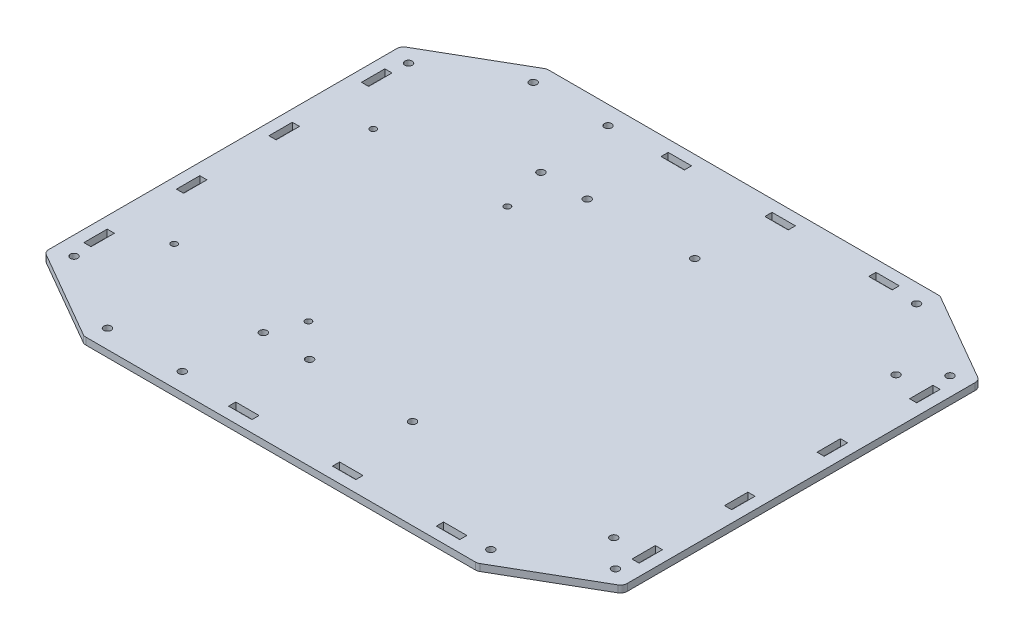
from build123d import *

# Parameters (mm, degrees)
SKETCH1_R           = 1.6
SKETCH1_W           = 10.1
SKETCH1_H           = 3.1
SKETCH1_W_2         = 3.1
SKETCH1_H_2         = 10.1
BOSS_EXTRUDE1_DEPTH = 3
CUT_EXTRUDE1_REACH  = 162.106
SKETCH3_R           = 1.35
SKETCH3_R_2         = 1.6
FILLET1_R           = 3


with BuildPart() as part:
    # Sketch1 → Boss-Extrude1 (new body)
    with BuildSketch(Plane(origin=(0, 0, 0), x_dir=(1, 0, 0), z_dir=(0, 1, 0))):
        Polygon((-85, 100), (85, 100), (125, 76.905989232), (125, -76.905989232), (85, -100), (-85, -100), (-125, -76.905989232), (-125, 76.905989232), align=None)
        with Locations(Location((-47.5, -60, 0), (0, 0, 270))):
            Circle(SKETCH1_R, mode=Mode.SUBTRACT)
        with Locations(Location((82.856406461, 92, 0), (0, 0, 270))):
            Circle(SKETCH1_R, mode=Mode.SUBTRACT)
        with Locations(Location((117, 72.287187079, 0), (0, 0, 270))):
            Circle(SKETCH1_R, mode=Mode.SUBTRACT)
        with Locations(Location((117, -72.287187079, 0), (0, 0, 270))):
            Circle(SKETCH1_R, mode=Mode.SUBTRACT)
        with Locations(Location((82.856406461, -92, 0), (0, 0, 270))):
            Circle(SKETCH1_R, mode=Mode.SUBTRACT)
        with Locations(Location((-27.5, -60, 0), (0, 0, 270))):
            Circle(SKETCH1_R, mode=Mode.SUBTRACT)
        with Locations(Location((-27.5, 60, 0), (0, 0, 270))):
            Circle(SKETCH1_R, mode=Mode.SUBTRACT)
        with Locations(Location((-117, -72.287187079, 0), (0, 0, 270))):
            Circle(SKETCH1_R, mode=Mode.SUBTRACT)
        with Locations(Location((-50.5, -92, 0), (0, 0, 270))):
            Circle(SKETCH1_R, mode=Mode.SUBTRACT)
        with Locations(Location((-47.5, 60, 0), (0, 0, 270))):
            Circle(SKETCH1_R, mode=Mode.SUBTRACT)
        with Locations(Location((-117, 72.287187079, 0), (0, 0, 270))):
            Circle(SKETCH1_R, mode=Mode.SUBTRACT)
        with Locations(Location((-50.5, 92, 0), (0, 0, 270))):
            Circle(SKETCH1_R, mode=Mode.SUBTRACT)
        with Locations(Location((-82.856406461, -92, 0), (0, 0, 270))):
            Circle(SKETCH1_R, mode=Mode.SUBTRACT)
        with Locations(Location((-82.856406461, 92, 0), (0, 0, 270))):
            Circle(SKETCH1_R, mode=Mode.SUBTRACT)
        with Locations((-22.45, -93.45)):
            Rectangle(SKETCH1_W, SKETCH1_H, mode=Mode.SUBTRACT)
        with Locations((-118.45, 60)):
            Rectangle(SKETCH1_W_2, SKETCH1_H_2, mode=Mode.SUBTRACT)
        with Locations((-118.45, 20)):
            Rectangle(SKETCH1_W_2, SKETCH1_H_2, mode=Mode.SUBTRACT)
        with Locations((-118.45, -20)):
            Rectangle(SKETCH1_W_2, SKETCH1_H_2, mode=Mode.SUBTRACT)
        with Locations((-118.45, -60)):
            Rectangle(SKETCH1_W_2, SKETCH1_H_2, mode=Mode.SUBTRACT)
        with Locations((118.45, -60)):
            Rectangle(SKETCH1_W_2, SKETCH1_H_2, mode=Mode.SUBTRACT)
        with Locations((118.45, -20)):
            Rectangle(SKETCH1_W_2, SKETCH1_H_2, mode=Mode.SUBTRACT)
        with Locations((118.45, 20)):
            Rectangle(SKETCH1_W_2, SKETCH1_H_2, mode=Mode.SUBTRACT)
        with Locations((118.45, 60)):
            Rectangle(SKETCH1_W_2, SKETCH1_H_2, mode=Mode.SUBTRACT)
        with Locations((22.45, -93.45)):
            Rectangle(SKETCH1_W, SKETCH1_H, mode=Mode.SUBTRACT)
        with Locations((67.35, -93.45)):
            Rectangle(SKETCH1_W, SKETCH1_H, mode=Mode.SUBTRACT)
        with Locations((67.35, 93.45)):
            Rectangle(SKETCH1_W, SKETCH1_H, mode=Mode.SUBTRACT)
        with Locations((22.45, 93.45)):
            Rectangle(SKETCH1_W, SKETCH1_H, mode=Mode.SUBTRACT)
        with Locations((-22.45, 93.45)):
            Rectangle(SKETCH1_W, SKETCH1_H, mode=Mode.SUBTRACT)
    extrude(amount=BOSS_EXTRUDE1_DEPTH)

    # Sketch3 → Cut-Extrude1 (cut, up to next)
    with BuildSketch(Plane(origin=(0, 3, 0), x_dir=(1, 0, 0), z_dir=(0, 1, 0)), mode=Mode.PRIVATE) as cut_extrude1_sk1:
        with Locations(Location((-100, -46, 0), (0, 0, 270))):
            Circle(SKETCH3_R)
    cut_extrude1_tool1 = extrude(cut_extrude1_sk1.sketch, amount=-CUT_EXTRUDE1_REACH, mode=Mode.PRIVATE) & part.part
    # Sketch3 → Cut-Extrude1 (cut, up to next)
    with BuildSketch(Plane(origin=(0, 3, 0), x_dir=(1, 0, 0), z_dir=(0, 1, 0)), mode=Mode.PRIVATE) as cut_extrude1_sk2:
        with Locations(Location((-42, -46, 0), (0, 0, 270))):
            Circle(SKETCH3_R)
    cut_extrude1_tool2 = extrude(cut_extrude1_sk2.sketch, amount=-CUT_EXTRUDE1_REACH, mode=Mode.PRIVATE) & part.part
    # Sketch3 → Cut-Extrude1 (cut, up to next)
    with BuildSketch(Plane(origin=(0, 3, 0), x_dir=(1, 0, 0), z_dir=(0, 1, 0)), mode=Mode.PRIVATE) as cut_extrude1_sk3:
        with Locations(Location((-42, 40, 0), (0, 0, 270))):
            Circle(SKETCH3_R)
    cut_extrude1_tool3 = extrude(cut_extrude1_sk3.sketch, amount=-CUT_EXTRUDE1_REACH, mode=Mode.PRIVATE) & part.part
    # Sketch3 → Cut-Extrude1 (cut, up to next)
    with BuildSketch(Plane(origin=(0, 3, 0), x_dir=(1, 0, 0), z_dir=(0, 1, 0)), mode=Mode.PRIVATE) as cut_extrude1_sk4:
        with Locations(Location((-100, 40, 0), (0, 0, 270))):
            Circle(SKETCH3_R)
    cut_extrude1_tool4 = extrude(cut_extrude1_sk4.sketch, amount=-CUT_EXTRUDE1_REACH, mode=Mode.PRIVATE) & part.part
    # Sketch3 → Cut-Extrude1 (cut, up to next)
    with BuildSketch(Plane(origin=(0, 3, 0), x_dir=(1, 0, 0), z_dir=(0, 1, 0)), mode=Mode.PRIVATE) as cut_extrude1_sk5:
        with Locations(Location((18, 61, 0), (0, 0, 270))):
            Circle(SKETCH3_R_2)
    cut_extrude1_tool5 = extrude(cut_extrude1_sk5.sketch, amount=-CUT_EXTRUDE1_REACH, mode=Mode.PRIVATE) & part.part
    # Sketch3 → Cut-Extrude1 (cut, up to next)
    with BuildSketch(Plane(origin=(0, 3, 0), x_dir=(1, 0, 0), z_dir=(0, 1, 0)), mode=Mode.PRIVATE) as cut_extrude1_sk6:
        with Locations(Location((105, 61, 0), (0, 0, 270))):
            Circle(SKETCH3_R_2)
    cut_extrude1_tool6 = extrude(cut_extrude1_sk6.sketch, amount=-CUT_EXTRUDE1_REACH, mode=Mode.PRIVATE) & part.part
    # Sketch3 → Cut-Extrude1 (cut, up to next)
    with BuildSketch(Plane(origin=(0, 3, 0), x_dir=(1, 0, 0), z_dir=(0, 1, 0)), mode=Mode.PRIVATE) as cut_extrude1_sk7:
        with Locations(Location((105, -61, 0), (0, 0, 270))):
            Circle(SKETCH3_R_2)
    cut_extrude1_tool7 = extrude(cut_extrude1_sk7.sketch, amount=-CUT_EXTRUDE1_REACH, mode=Mode.PRIVATE) & part.part
    # Sketch3 → Cut-Extrude1 (cut, up to next)
    with BuildSketch(Plane(origin=(0, 3, 0), x_dir=(1, 0, 0), z_dir=(0, 1, 0)), mode=Mode.PRIVATE) as cut_extrude1_sk8:
        with Locations(Location((18, -61, 0), (0, 0, 270))):
            Circle(SKETCH3_R_2)
    cut_extrude1_tool8 = extrude(cut_extrude1_sk8.sketch, amount=-CUT_EXTRUDE1_REACH, mode=Mode.PRIVATE) & part.part
    add(cut_extrude1_tool1.solids().sort_by_distance((-100, 3, 46))[0], mode=Mode.SUBTRACT)
    add(cut_extrude1_tool2.solids().sort_by_distance((-42, 3, 46))[0], mode=Mode.SUBTRACT)
    add(cut_extrude1_tool3.solids().sort_by_distance((-42, 3, -40))[0], mode=Mode.SUBTRACT)
    add(cut_extrude1_tool4.solids().sort_by_distance((-100, 3, -40))[0], mode=Mode.SUBTRACT)
    add(cut_extrude1_tool5.solids().sort_by_distance((18, 3, -61))[0], mode=Mode.SUBTRACT)
    add(cut_extrude1_tool6.solids().sort_by_distance((105, 3, -61))[0], mode=Mode.SUBTRACT)
    add(cut_extrude1_tool7.solids().sort_by_distance((105, 3, 61))[0], mode=Mode.SUBTRACT)
    add(cut_extrude1_tool8.solids().sort_by_distance((18, 3, 61))[0], mode=Mode.SUBTRACT)

    # Fillet1
    fillet1_edges = [part.edges().sort_by_distance(p)[0] for p in [
        (-85, 1.5, -100),
        (85, 1.5, -100),
        (125, 1.5, -76.905989232),
        (125, 1.5, 76.905989232),
        (85, 1.5, 100),
        (-85, 1.5, 100),
        (-125, 1.5, 76.905989232),
        (-125, 1.5, -76.905989232),
    ]]
    fillet(fillet1_edges, radius=FILLET1_R)


solid = part.part
